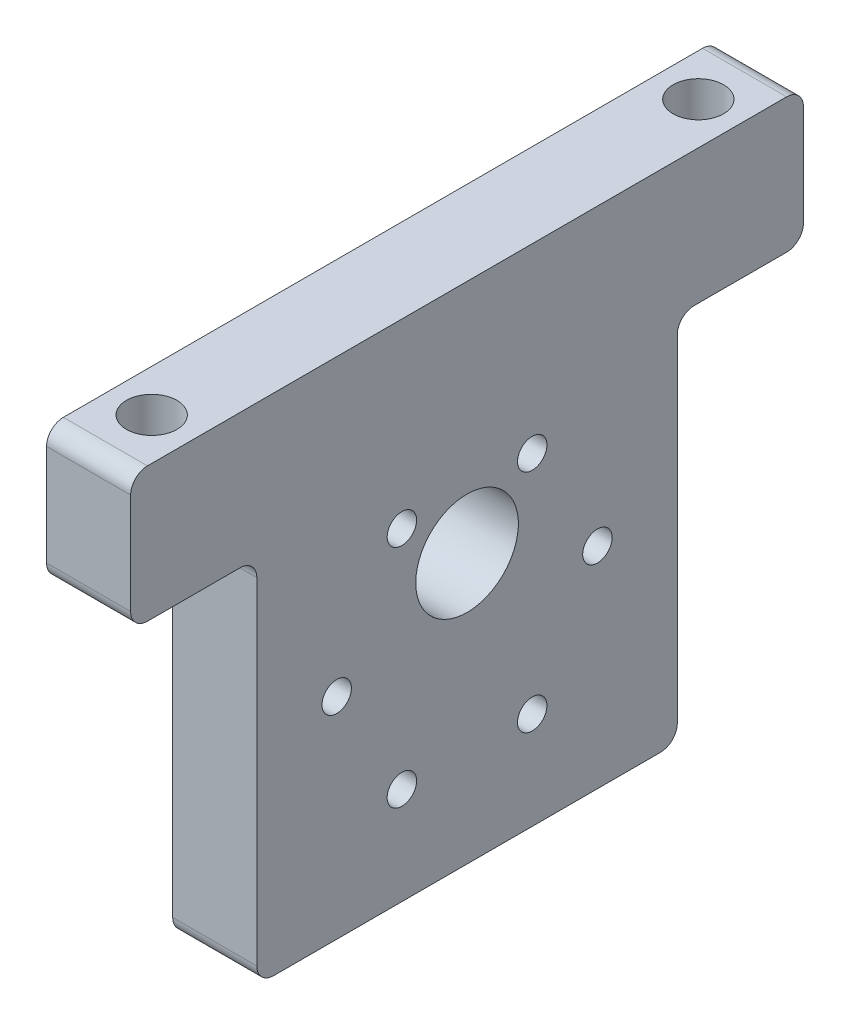
from build123d import *

# Parameters (mm, degrees)
SKETCH1_W           = 80
SKETCH1_H           = 60
BOSS_EXTRUDE1_DEPTH = 10
SKETCH2_R           = 6.1
CUT_EXTRUDE1_DEPTH  = 55.083269132
SKETCH3_R           = 1.75
CUT_EXTRUDE3_DEPTH  = 55.083269132
SKETCH4_W           = 15
SKETCH4_H           = 44
CUT_EXTRUDE4_DEPTH  = 50
SKETCH5_R           = 3
CUT_EXTRUDE5_DEPTH  = 50
FILLET1_R           = 2


with BuildPart() as part:
    # Sketch1 → Boss-Extrude1 (new body)
    with BuildSketch(Plane(origin=(0, 0, 0), x_dir=(0, 0, -1), z_dir=(1, 0, 0))):
        with Locations((0, 5)):
            Rectangle(SKETCH1_W, SKETCH1_H)
    extrude(amount=BOSS_EXTRUDE1_DEPTH)

    # Sketch2 → Cut-Extrude1 (cut, through all)
    with BuildSketch(Plane(origin=(10, 0, 0), x_dir=(0, 0, -1), z_dir=(1, 0, 0))):
        with Locations(Location((0, 7, 0), (0, 0, 180))):
            Circle(SKETCH2_R)
    extrude(amount=-CUT_EXTRUDE1_DEPTH, mode=Mode.SUBTRACT)

    # Sketch3 → Cut-Extrude3 (cut, through all)
    with BuildSketch(Plane(origin=(10, 0, 0), x_dir=(0, 0, -1), z_dir=(1, 0, 0))):
        with Locations((7.75, -13.423393759)):
            Circle(SKETCH3_R)
        with Locations(Location((-7.75, -13.423393759, 0), (0, 0, 180))):
            Circle(SKETCH3_R)
        with Locations((-7.75, 13.423393759)):
            Circle(SKETCH3_R)
        with Locations(Location((7.75, 13.423393759, 0), (0, 0, 180))):
            Circle(SKETCH3_R)
        with Locations((15.5, 0)):
            Circle(SKETCH3_R)
        with Locations(Location((-15.5, 0, 0), (0, 0, 180))):
            Circle(SKETCH3_R)
    extrude(amount=-CUT_EXTRUDE3_DEPTH, mode=Mode.SUBTRACT)

    # Sketch4 → Cut-Extrude4 (cut)
    with BuildSketch(Plane(origin=(10, 0, 0), x_dir=(0, 0, -1), z_dir=(1, 0, 0))):
        with Locations((-32.5, -3)):
            Rectangle(SKETCH4_W, SKETCH4_H)
        with Locations((32.5, -3)):
            Rectangle(SKETCH4_W, SKETCH4_H)
    extrude(amount=-CUT_EXTRUDE4_DEPTH, mode=Mode.SUBTRACT)

    # Sketch5 → Cut-Extrude5 (cut)
    with BuildSketch(Plane(origin=(0, 35, 0), x_dir=(1, 0, 0), z_dir=(0, 1, 0))):
        with Locations(Location((5, 32.5, 0), (0, 0, 270))):
            Circle(SKETCH5_R)
        with Locations(Location((5, -32.5, 0), (0, 0, 270))):
            Circle(SKETCH5_R)
    extrude(amount=-CUT_EXTRUDE5_DEPTH, mode=Mode.SUBTRACT)

    # Fillet1
    fillet1_edges = [part.edges().sort_by_distance(p)[0] for p in [
        (5, 19, 40),
        (5, 19, 25),
        (5, -25, 25),
        (5, -25, -25),
        (5, 19, -25),
        (5, 19, -40),
        (5, 35, 40),
        (5, 35, -40),
    ]]
    fillet(fillet1_edges, radius=FILLET1_R)


solid = part.part
